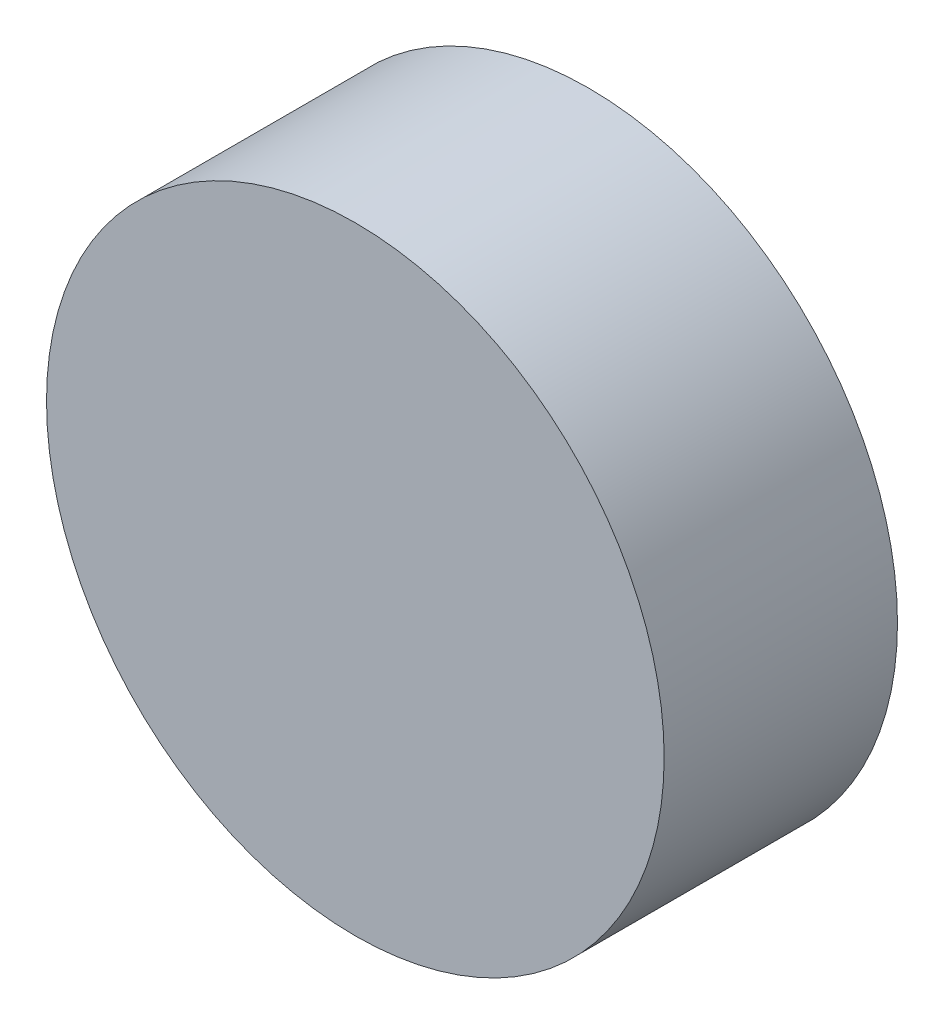
from build123d import *

# Parameters (mm, degrees)
SKETCH1_R           = 2.25
BOSS_EXTRUDE1_DEPTH = 0.85


with BuildPart() as part:
    # Sketch1 → Boss-Extrude1 (new, symmetric)
    with BuildSketch(Plane.XY):
        Circle(SKETCH1_R)
    extrude(amount=BOSS_EXTRUDE1_DEPTH, both=True)


solid = part.part
